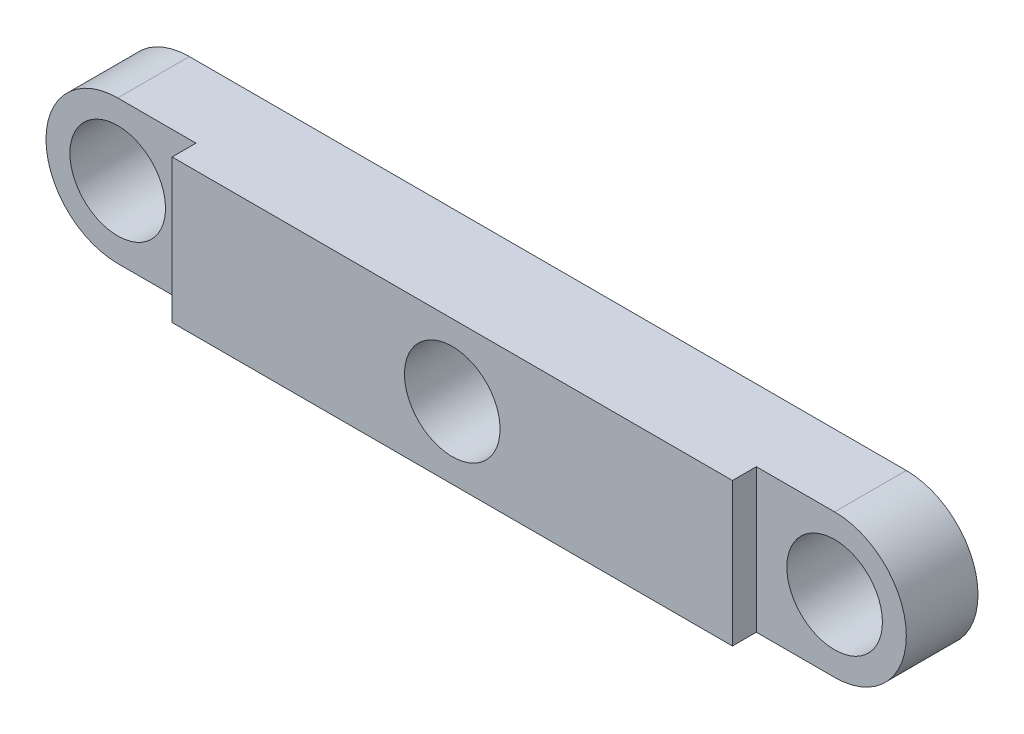
from build123d import *

# Parameters (mm, degrees)
SKETCH_1_R          = 10
EXTRUDE_1_DEPTH     = 10
SKETCH_2_W          = 35.259791695
SKETCH_2_H          = 30
CUT_EXTRUDE_1_DEPTH = 5


with BuildPart() as part:
    # Эскиз1 → Бобышка-Вытянуть1 (new, symmetric)
    with BuildSketch(Plane.XY):
        with BuildLine():
            Line((-75, 15), (75, 15))
            ThreePointArc((75, 15), (90, 0), (75, -15))
            Line((75, -15), (-75, -15))
            ThreePointArc((-75, -15), (-90, 0), (-75, 15))
        make_face()
        with Locations((-75, 0)):
            Circle(SKETCH_1_R, mode=Mode.SUBTRACT)
        Circle(SKETCH_1_R, mode=Mode.SUBTRACT)
        with Locations((75, 0)):
            Circle(SKETCH_1_R, mode=Mode.SUBTRACT)
    extrude(amount=EXTRUDE_1_DEPTH, both=True)

    # Эскиз2 → Вырез-Вытянуть1 (cut)
    with BuildSketch(Plane.XY.offset(10)):
        with Locations((-76.250006928, 0)):
            Rectangle(SKETCH_2_W, SKETCH_2_H)
        with Locations((76.250006928, 0)):
            Rectangle(SKETCH_2_W, SKETCH_2_H)
    extrude(amount=-CUT_EXTRUDE_1_DEPTH, mode=Mode.SUBTRACT)


solid = part.part
